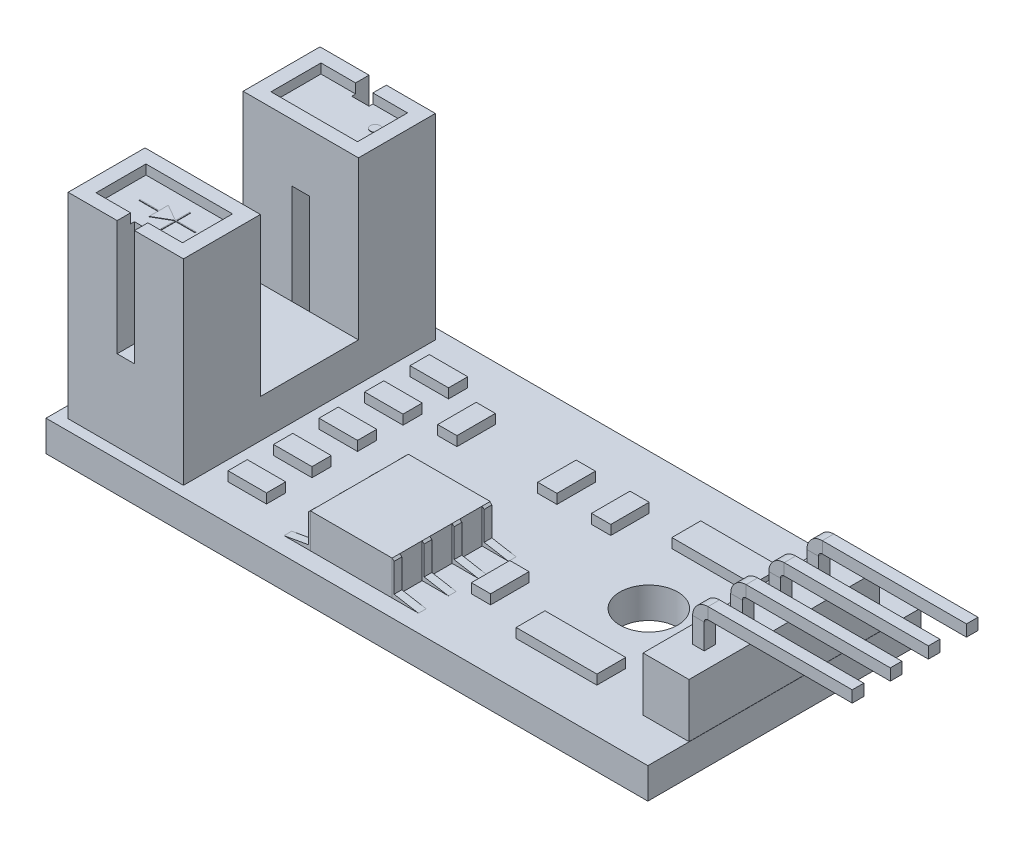
from build123d import *

# Parameters (mm, degrees)
SKETCH1_W               = 31.3
SKETCH1_H               = 14.2
BOSS_EXTRUDE1_DEPTH     = 0.8
SKETCH2_W               = 6
SKETCH2_H               = 13.1
BOSS_EXTRUDE2_DEPTH     = 2
SKETCH3_W               = 6
SKETCH3_H               = 4
BOSS_EXTRUDE3_DEPTH     = 8.2
SKETCH4_W               = 0.9
SKETCH4_H               = 6
CUT_EXTRUDE1_DEPTH      = 0.9
SKETCH5_W               = 0.9
SKETCH5_H               = 7.2
CUT_EXTRUDE2_DEPTH      = 0.9
SKETCH6_W               = 4.5
SKETCH6_H               = 2.6
CUT_EXTRUDE3_DEPTH      = 0.5
CUT_EXTRUDE4_DEPTH      = 21.846402567
CUT_EXTRUDE4_DEPTH_BACK = 21.846402567
SKETCH7_R               = 1.5
SKETCH8_W               = 2.4
SKETCH8_H               = 9.9
BOSS_EXTRUDE4_DEPTH     = 2.8
SKETCH9_W               = 4.25
SKETCH9_H               = 5.1
BOSS_EXTRUDE5_DEPTH     = 1.8
CUT_EXTRUDE5_DEPTH      = 19.710758937
CUT_EXTRUDE5_DEPTH_BACK = 19.710758937
SKETCH10_W              = 0.6
SKETCH10_H              = 0.6
SKETCH11_R              = 0.25
BOSS_EXTRUDE11_DEPTH    = 0.02
BOSS_EXTRUDE14_DEPTH    = 0.4
BOSS_EXTRUDE14_2_DEPTH  = 0.4
LPATTERN1_COUNT         = 4
LPATTERN1_PITCH         = 1.56
SKETCH16_W              = 2
SKETCH16_H              = 1
SKETCH16_W_2            = 1
SKETCH16_H_2            = 2
SKETCH16_W_3            = 4.2
SKETCH16_H_3            = 1.5
BOSS_EXTRUDE15_DEPTH    = 0.5
SKETCH17_W              = 1.4
SKETCH17_H              = 1.4
CUT_EXTRUDE6_DEPTH      = 1.6
SKETCH18_W              = 0.6
SKETCH18_H              = 0.6
SKETCH20_W              = 9.9
SKETCH20_H              = 2.8
CUT_EXTRUDE7_DEPTH      = 0.01
SKETCH21_W              = 0.6
SKETCH21_H              = 0.6


with BuildPart() as part:
    # Sketch1 → Boss-Extrude1 (new, symmetric)
    with BuildSketch(Plane(origin=(0, 0, 0), x_dir=(1, 0, 0), z_dir=(0, 1, 0))):
        Rectangle(SKETCH1_W, SKETCH1_H)
    extrude(amount=BOSS_EXTRUDE1_DEPTH, both=True)

    # Sketch2 → Boss-Extrude2 (add)
    with BuildSketch(Plane(origin=(0, 0.8, 0), x_dir=(1, 0, 0), z_dir=(0, 1, 0))):
        with Locations((-12.05, 0)):
            Rectangle(SKETCH2_W, SKETCH2_H)
    extrude(amount=BOSS_EXTRUDE2_DEPTH)

    # Sketch3 → Boss-Extrude3 (add)
    with BuildSketch(Plane(origin=(0, 2.8, 0), x_dir=(1, 0, 0), z_dir=(0, 1, 0))):
        with Locations((-12.05, -4.55)):
            Rectangle(SKETCH3_W, SKETCH3_H)
        with Locations((-12.05, 4.55)):
            Rectangle(SKETCH3_W, SKETCH3_H)
    extrude(amount=BOSS_EXTRUDE3_DEPTH)

    # Sketch4 → Cut-Extrude1 (cut)
    with BuildSketch(Plane.XY.offset(6.55)):
        with Locations((-12.05, 8)):
            Rectangle(SKETCH4_W, SKETCH4_H)
    cut_extrude1 = extrude(amount=-CUT_EXTRUDE1_DEPTH, mode=Mode.SUBTRACT)

    # Mirror1: Cut-Extrude1 across plane
    add(cut_extrude1.mirror(Plane.XY), mode=Mode.SUBTRACT)

    # Sketch5 → Cut-Extrude2 (cut)
    with BuildSketch(Plane(origin=(0, 0, 2.55), x_dir=(-1, 0, 0), z_dir=(0, 0, -1))):
        with Locations((12.05, 4.4)):
            Rectangle(SKETCH5_W, SKETCH5_H)
    cut_extrude2 = extrude(amount=-CUT_EXTRUDE2_DEPTH, mode=Mode.SUBTRACT)

    # Mirror2: Cut-Extrude2 across plane
    add(cut_extrude2.mirror(Plane.XY), mode=Mode.SUBTRACT)

    # Sketch6 → Cut-Extrude3 (cut)
    with BuildSketch(Plane(origin=(0, 11, 0), x_dir=(1, 0, 0), z_dir=(0, 1, 0))):
        with Locations((-12.05, 4.55)):
            Rectangle(SKETCH6_W, SKETCH6_H)
        with Locations((-12.05, -4.55)):
            Rectangle(SKETCH6_W, SKETCH6_H)
    extrude(amount=-CUT_EXTRUDE3_DEPTH, mode=Mode.SUBTRACT)

    # Sketch7 → Cut-Extrude4 (cut, two sides: drawn at the far end of the back side and taken through both)
    with BuildSketch(Plane.XZ.offset(0.8).offset(-CUT_EXTRUDE4_DEPTH_BACK)):
        with Locations(Location((8.6, 0, 0), (0, 0, 90))):
            Circle(SKETCH7_R)
    extrude(amount=CUT_EXTRUDE4_DEPTH + CUT_EXTRUDE4_DEPTH_BACK, mode=Mode.SUBTRACT)

    # Sketch9 → Boss-Extrude5 (add)
    with BuildSketch(Plane(origin=(0, 0.8, 0), x_dir=(1, 0, 0), z_dir=(0, 1, 0))):
        with Locations((-0.675, -3.65)):
            Rectangle(SKETCH9_W, SKETCH9_H)
    extrude(amount=BOSS_EXTRUDE5_DEPTH)


with BuildPart() as body_2:
    # Sketch8 → Boss-Extrude4 (new body)
    with BuildSketch(Plane(origin=(0, 0.8, 0), x_dir=(1, 0, 0), z_dir=(0, 1, 0))):
        with Locations((14.45, 0)):
            Rectangle(SKETCH8_W, SKETCH8_H)
    extrude(amount=BOSS_EXTRUDE4_DEPTH)


with BuildPart() as cut_extrude5_tool:
    # Sketch10 → Cut-Extrude5 (new, two sides: drawn at the far end of the back side and taken through both)
    with BuildSketch(Plane(origin=(0, 3.6, 0), x_dir=(1, 0, 0), z_dir=(0, 1, 0)).offset(-CUT_EXTRUDE5_DEPTH_BACK)):
        with Locations((14.45, 2.97)):
            Rectangle(SKETCH10_W, SKETCH10_H)
        with Locations((14.45, 0.99)):
            Rectangle(SKETCH10_W, SKETCH10_H)
        with Locations((14.45, -2.97)):
            Rectangle(SKETCH10_W, SKETCH10_H)
        with Locations((14.45, -0.99)):
            Rectangle(SKETCH10_W, SKETCH10_H)
    extrude(amount=CUT_EXTRUDE5_DEPTH + CUT_EXTRUDE5_DEPTH_BACK)


with BuildPart() as part_1:
    add(part.part)

    # Cut-Extrude5: cut by cut_extrude5_tool
    add(cut_extrude5_tool.part, mode=Mode.SUBTRACT)

    # Sketch11 → Boss-Extrude11 (add)
    with BuildSketch(Plane(origin=(0, 10.5, 0), x_dir=(1, 0, 0), z_dir=(0, 1, 0))):
        with Locations(Location((-10.422649731, 4.797077126, 0), (0, 0, 270))):
            Circle(SKETCH11_R)
        Polygon((-13.338675135, -4.575), (-12.338675135, -4.575), (-12.338675135, -5.05), (-11.490483518, -4.560296342), (-11.472649731, -4.560296342), (-11.472649731, -5.3), (-11.422649731, -5.3), (-11.422649731, -4.575), (-10.422649731, -4.575), (-10.422649731, -4.525), (-11.422649731, -4.525), (-11.422649731, -3.8), (-11.472649731, -3.8), (-11.472649731, -4.539703658), (-11.490483518, -4.539703658), (-12.338675135, -4.05), (-12.338675135, -4.525), (-13.338675135, -4.525), align=None)
    extrude(amount=BOSS_EXTRUDE11_DEPTH)


with BuildPart() as body_2_1:
    add(body_2.part)

    # Cut-Extrude5: cut by cut_extrude5_tool
    add(cut_extrude5_tool.part, mode=Mode.SUBTRACT)


with BuildPart() as body_3:
    # Sketch15 → Boss-Extrude14 (new body)
    with BuildSketch(Plane.XY.offset(6.2)):
        Polygon((1.45, 0.8), (1.45, 2.6), (1.555574346, 2.503632875), (1.555574346, 1.022751974), (2.821054388, 0.8), align=None)
    boss_extrude14 = extrude(amount=-BOSS_EXTRUDE14_DEPTH)


with BuildPart() as body_4:
    # Sketch15 → Boss-Extrude14 2 (new body)
    with BuildSketch(Plane.XY.offset(6.2)):
        Polygon((-4.171054388, 0.8), (-2.8, 0.8), (-2.8, 2.6), (-2.905574346, 2.503632875), (-2.905574346, 1.022751974), align=None)
    boss_extrude14_2 = extrude(amount=-BOSS_EXTRUDE14_2_DEPTH)


with BuildPart() as part_2:
    add(part_1.part)

    # LPattern1: Boss-Extrude14, Boss-Extrude14 2 ×4
    with Locations(*[(0, 0, -i * LPATTERN1_PITCH) for i in range(1, LPATTERN1_COUNT)]):
        add(boss_extrude14)
        add(boss_extrude14_2)

    # Sketch16 → Boss-Extrude15 (add)
    with BuildSketch(Plane(origin=(0, 0.8, 0), x_dir=(1, 0, 0), z_dir=(0, 1, 0))):
        with Locations((-7.05, -2.366666667)):
            Rectangle(SKETCH16_W, SKETCH16_H)
        with Locations((-7.05, -4.733333333)):
            Rectangle(SKETCH16_W, SKETCH16_H)
        with Locations((-7.05, 0)):
            Rectangle(SKETCH16_W, SKETCH16_H)
        with Locations((-7.05, 2.366666667)):
            Rectangle(SKETCH16_W, SKETCH16_H)
        with Locations((-7.05, 4.733333333)):
            Rectangle(SKETCH16_W, SKETCH16_H)
        with Locations((1.021054388, 3.3)):
            Rectangle(SKETCH16_W_2, SKETCH16_H_2)
        with Locations((-4.178945612, 3.3)):
            Rectangle(SKETCH16_W_2, SKETCH16_H_2)
        with Locations((3.821054388, 3.3)):
            Rectangle(SKETCH16_W_2, SKETCH16_H_2)
        with Locations((3.821054388, -2.95)):
            Rectangle(SKETCH16_W_2, SKETCH16_H_2)
        with Locations((8.6, -4.05)):
            Rectangle(SKETCH16_W_3, SKETCH16_H_3)
        with Locations((8.6, 4.05)):
            Rectangle(SKETCH16_W_3, SKETCH16_H_3)
    extrude(amount=BOSS_EXTRUDE15_DEPTH)

    # Sketch17 → Cut-Extrude6 (cut)
    with BuildSketch(Plane.XZ.offset(0.8)):
        with Locations((-12.95, 5.1)):
            Rectangle(SKETCH17_W, SKETCH17_H)
        with Locations((-10.55, 5.1)):
            Rectangle(SKETCH17_W, SKETCH17_H)
        with Locations((-10.55, -5.1)):
            Rectangle(SKETCH17_W, SKETCH17_H)
        with Locations((-12.95, -5.1)):
            Rectangle(SKETCH17_W, SKETCH17_H)
    extrude(amount=-CUT_EXTRUDE6_DEPTH, mode=Mode.SUBTRACT)

    add(body_2_1.part)  # Sweep2 merges body 2
    # Sweep2: sweep along a path in Sketch19
    with BuildLine(Plane.XY.offset(2.97)) as sweep2_path:
        Line((22.45, 5.4), (14.95, 5.4))
        ThreePointArc((14.95, 5.4), (14.596446609, 5.253553391), (14.45, 4.9))
        Line((14.45, 4.9), (14.45, 3.6))
        Line((14.45, 3.6), (14.45, -1.3))
    # Sketch18 → Sweep2 (sweep)
    with BuildSketch(Plane(origin=(0, 3.6, 0), x_dir=(1, 0, 0), z_dir=(0, 1, 0))):
        with Locations((14.45, -2.97)):
            Rectangle(SKETCH18_W, SKETCH18_H)
    sweep2 = sweep(path=sweep2_path.line)

    # Mirror3: Sweep2 across plane
    add(sweep2.mirror(Plane.XY))

    # Sketch20 → Cut-Extrude7 (cut)
    with BuildSketch(Plane(origin=(15.65, 0, 0), x_dir=(0, 0, -1), z_dir=(1, 0, 0))):
        with Locations((0, 2.2)):
            Rectangle(SKETCH20_W, SKETCH20_H)
    extrude(amount=-CUT_EXTRUDE7_DEPTH, mode=Mode.SUBTRACT)

    # Sweep3: sweep along a path in Sketch22
    with BuildLine(Plane.XY.offset(0.99)) as sweep3_path:
        Line((14.45, -1.3), (14.45, 4.9))
        ThreePointArc((14.45, 4.9), (14.596446609, 5.253553391), (14.95, 5.4))
        Line((14.95, 5.4), (22.45, 5.4))
    # Sketch21 → Sweep3 (sweep)
    with BuildSketch(Plane(origin=(0, 3.6, 0), x_dir=(1, 0, 0), z_dir=(0, 1, 0))):
        with Locations((14.45, -0.99)):
            Rectangle(SKETCH21_W, SKETCH21_H)
    sweep3 = sweep(path=sweep3_path.line)

    # Mirror4: Sweep3 across plane
    add(sweep3.mirror(Plane.XY))


solid = Compound([body_3.part, body_4.part, part_2.part])
